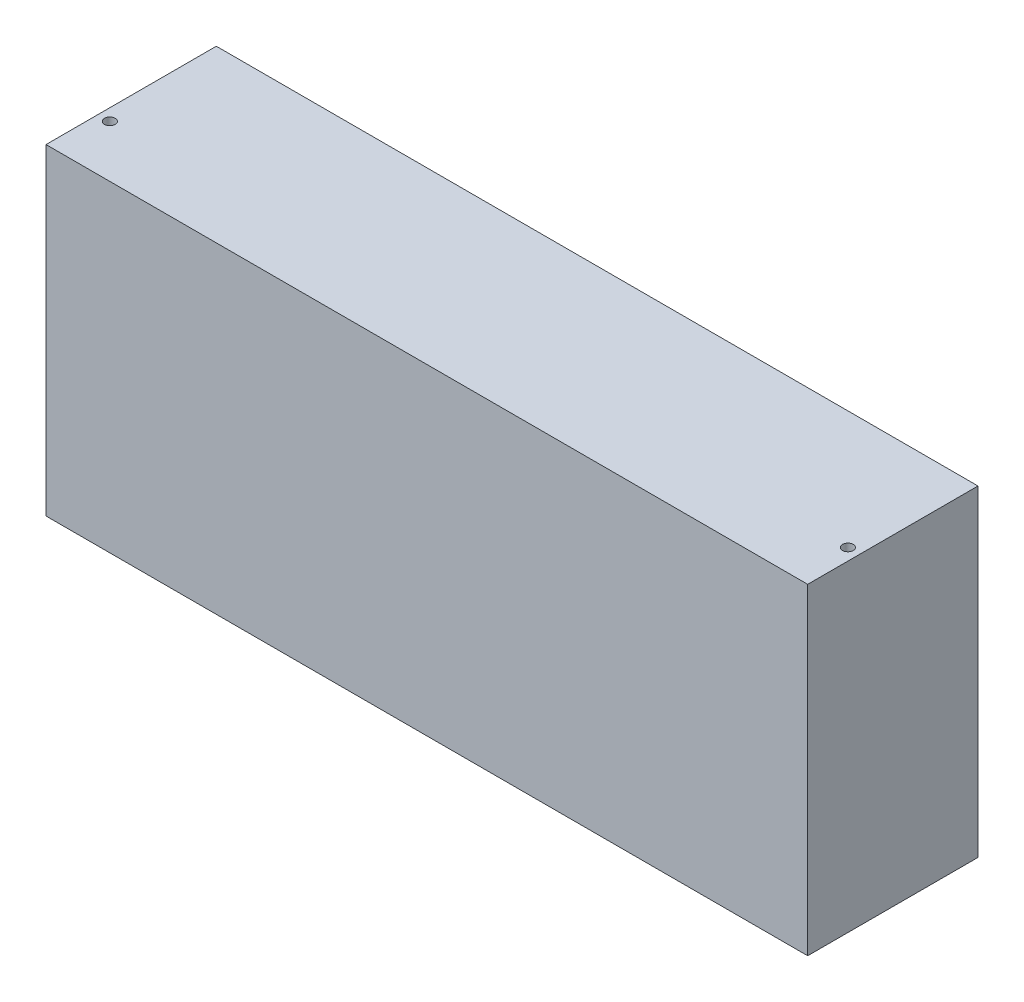
from build123d import *

# Parameters (mm, degrees)
SKETCH1_W           = 161
SKETCH1_H           = 36
SKETCH1_R           = 1.1303
BOSS_EXTRUDE1_DEPTH = 68


with BuildPart() as part:
    # Sketch1 → Boss-Extrude1 (new body)
    with BuildSketch(Plane(origin=(0, 0, 0), x_dir=(1, 0, 0), z_dir=(0, 1, 0))):
        Rectangle(SKETCH1_W, SKETCH1_H)
        with Locations(Location((78, -7, 0), (0, 0, 270))):
            Circle(SKETCH1_R, mode=Mode.SUBTRACT)
        with Locations(Location((-78, -7, 0), (0, 0, 90))):
            Circle(SKETCH1_R, mode=Mode.SUBTRACT)
    extrude(amount=BOSS_EXTRUDE1_DEPTH)


solid = part.part
